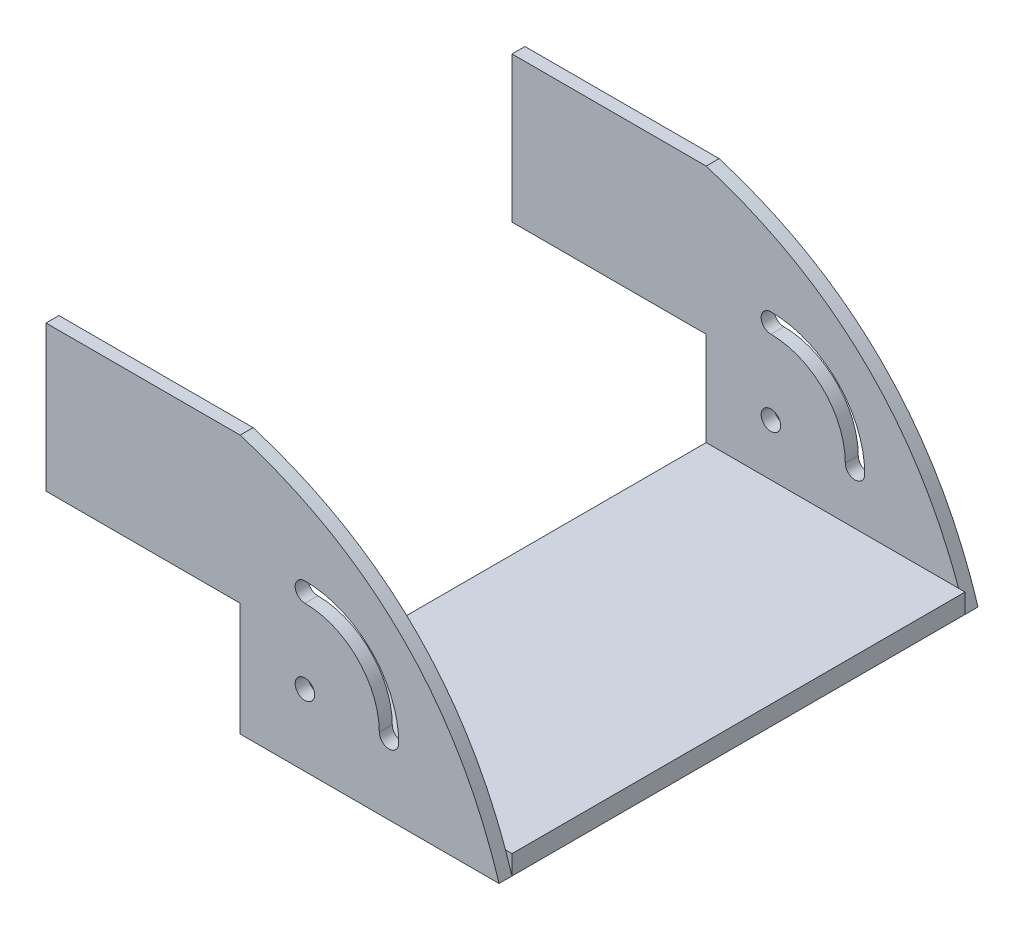
from build123d import *

# Parameters (mm, degrees)
ESQUISSE1_W                = 40
ESQUISSE1_H                = 3
BOSS_EXTRU_2_DEPTH         = 70
ESQUISSE3_R                = 1.5
BOSS_EXTRU_3_DEPTH         = 2
R_P_TITION_LIN_AIRE1_COUNT = 2
R_P_TITION_LIN_AIRE1_PITCH = 72


with BuildPart() as part:
    # Esquisse1 → Boss.-Extru.2 (new body)
    with BuildSketch(Plane.XY):
        with Locations((-9.056759605, -7.756756757)):
            Rectangle(ESQUISSE1_W, ESQUISSE1_H)
    extrude(amount=BOSS_EXTRU_2_DEPTH)

    # Esquisse3 → Boss.-Extru.3 (add)
    with BuildSketch(Plane.XY.offset(70)):
        with BuildLine():
            Line((-29.056759605, -9.256756757), (10.943240395, -9.256756757))
            add(Edge.make_bspline(
                [(-29.056759605, 30.743243243), (1.359242572, 21.353115069), (10.943240395, -9.256756757)],
                knots=[0, 0, 0, 1, 1, 1], degree=2))
            Line((-29.056759605, 30.743243243), (-59.056759605, 30.743243243))
            Line((-59.056759605, 30.743243243), (-59.056759605, 8.243243243))
            Line((-59.056759605, 8.243243243), (-29.056759605, 8.243243243))
            Line((-29.056759605, 8.243243243), (-29.056759605, -9.256756757))
        make_face()
        with Locations((-19.056759605, 1.743243243)):
            Circle(ESQUISSE3_R, mode=Mode.SUBTRACT)
        with BuildLine():
            ThreePointArc((-4.556759605, 1.743243243), (-8.803711277, 11.99629157), (-19.056759605, 16.243243243))
            ThreePointArc((-19.056759605, 16.243243243), (-20.556759605, 14.743243243), (-19.056759605, 13.243243243))
            ThreePointArc((-19.056759605, 13.243243243), (-10.925031621, 9.874971227), (-7.556759605, 1.743243243))
            ThreePointArc((-7.556759605, 1.743243243), (-6.056759605, 0.243243243), (-4.556759605, 1.743243243))
        make_face(mode=Mode.SUBTRACT)
    boss_extru_3 = extrude(amount=BOSS_EXTRU_3_DEPTH)

    # Répétition linéaire1: Boss.-Extru.3 ×2
    with Locations(*[(0, 0, -i * R_P_TITION_LIN_AIRE1_PITCH) for i in range(1, R_P_TITION_LIN_AIRE1_COUNT)]):
        add(boss_extru_3)


solid = part.part
